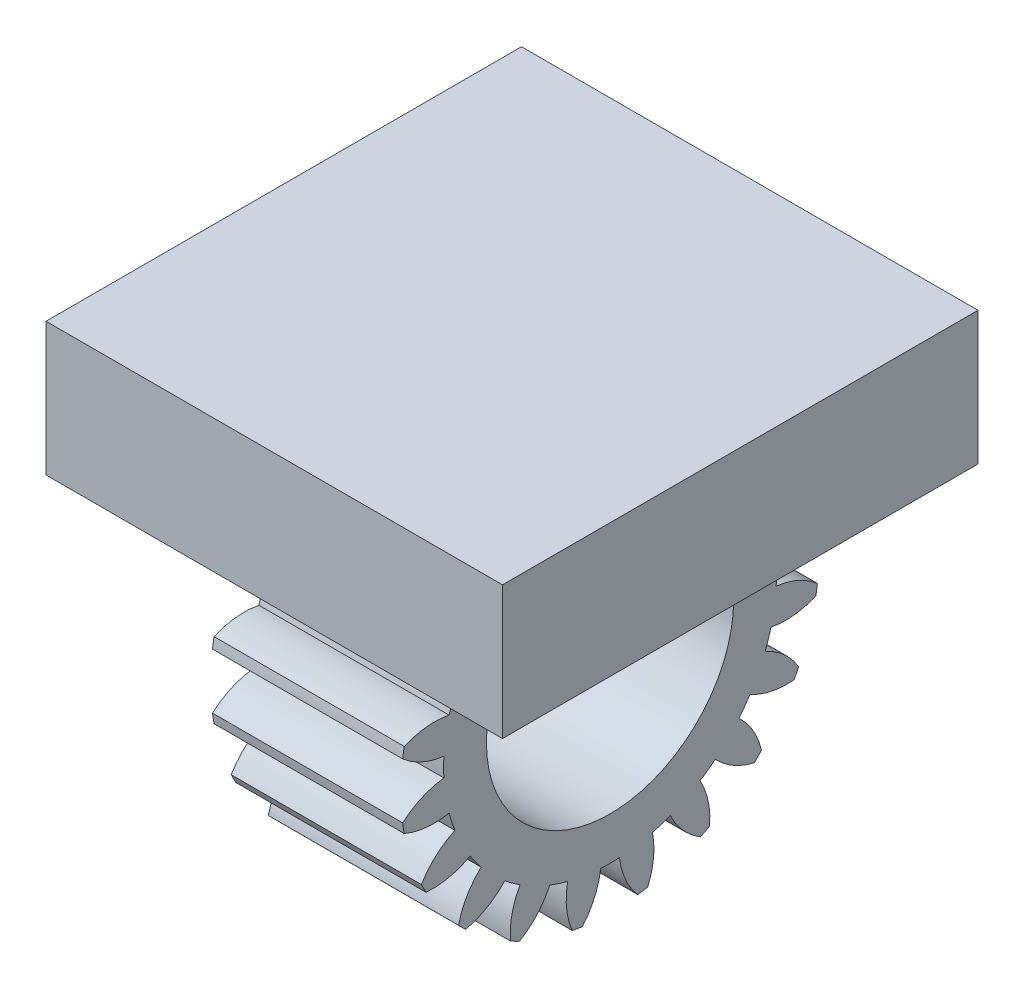
from build123d import *

# Parameters (mm, degrees)
SKETCH1_R                = 13
BOSS_EXTRUDE1_DEPTH      = 20
BOSS_EXTRUDE2_DEPTH      = 14
BOSS_EXTRUDE2_DEPTH_BACK = 34
SKETCH2_W                = 50
SKETCH2_H                = 14


with BuildPart() as part:
    # Sketch1 → Boss-Extrude1 (new body)
    with BuildSketch(Plane(origin=(30.485241984, 0, 0), x_dir=(0, 0, -1), z_dir=(1, 0, 0))):
        with BuildLine():
            ThreePointArc((-45.730813467, -2.952037332), (-43.709327628, -4.244029096), (-41.395669142, -4.878562094))
            ThreePointArc((-41.395669142, -4.878562094), (-41.423479526, -5.864733686), (-41.395669142, -6.850905277))
            ThreePointArc((-41.395669142, -6.850905277), (-43.709327628, -7.485438275), (-45.730813467, -8.777430039))
            ThreePointArc((-45.730813467, -8.777430039), (-45.653623019, -9.306291917), (-45.56360819, -9.833122612))
            ThreePointArc((-45.56360819, -9.833122612), (-43.241813498, -10.43720632), (-40.845312039, -10.325723271))
            ThreePointArc((-40.845312039, -10.325723271), (-40.567017505, -11.27222207), (-40.235824477, -12.201533107))
            ThreePointArc((-40.235824477, -12.201533107), (-42.240162977, -13.519969641), (-43.763462845, -15.373400306))
            ThreePointArc((-43.763462845, -15.373400306), (-43.526623058, -15.85252468), (-43.278214231, -16.325754333))
            ThreePointArc((-43.278214231, -16.325754333), (-40.883384128, -16.182798063), (-38.638625955, -15.336211705))
            ThreePointArc((-38.638625955, -15.336211705), (-38.081467911, -16.150387816), (-37.47931172, -16.931870859))
            ThreePointArc((-37.47931172, -16.931870859), (-38.978131616, -18.805153175), (-39.854134309, -21.038596032))
            ThreePointArc((-39.854134309, -21.038596032), (-39.480828712, -21.421082872), (-39.098341873, -21.794388468))
            ThreePointArc((-39.098341873, -21.794388468), (-36.864899015, -20.918385775), (-34.991616699, -19.419565879))
            ThreePointArc((-34.991616699, -19.419565879), (-34.210133656, -20.02172207), (-33.395957546, -20.578880114))
            ThreePointArc((-33.395957546, -20.578880114), (-34.242543904, -22.823638287), (-34.385500174, -25.21846839))
            ThreePointArc((-34.385500174, -25.21846839), (-33.91227052, -25.466877218), (-33.433146146, -25.703717004))
            ThreePointArc((-33.433146146, -25.703717004), (-31.579715481, -24.180417136), (-30.261278947, -22.176078636))
            ThreePointArc((-30.261278947, -22.176078636), (-29.331967911, -22.507271664), (-28.385469111, -22.785566198))
            ThreePointArc((-28.385469111, -22.785566198), (-28.49695216, -25.182067658), (-27.892868452, -27.50386235))
            ThreePointArc((-27.892868452, -27.50386235), (-27.366037757, -27.593877179), (-26.83717588, -27.671067627))
            ThreePointArc((-26.83717588, -27.671067627), (-25.545184115, -25.649581788), (-24.910651117, -23.335923302))
            ThreePointArc((-24.910651117, -23.335923302), (-23.924479526, -23.363733686), (-22.938307935, -23.335923302))
            ThreePointArc((-22.938307935, -23.335923302), (-22.303774937, -25.649581788), (-21.011783173, -27.671067627))
            ThreePointArc((-21.011783173, -27.671067627), (-20.482921295, -27.593877179), (-19.9560906, -27.50386235))
            ThreePointArc((-19.9560906, -27.50386235), (-19.352006892, -25.182067658), (-19.463489941, -22.785566198))
            ThreePointArc((-19.463489941, -22.785566198), (-18.516991142, -22.507271664), (-17.587680105, -22.176078636))
            ThreePointArc((-17.587680105, -22.176078636), (-16.269243571, -24.180417136), (-14.415812906, -25.703717004))
            ThreePointArc((-14.415812906, -25.703717004), (-13.936688532, -25.466877218), (-13.463458878, -25.21846839))
            ThreePointArc((-13.463458878, -25.21846839), (-13.606415149, -22.823638287), (-14.453001507, -20.578880114))
            ThreePointArc((-14.453001507, -20.578880114), (-13.638825396, -20.02172207), (-12.857342353, -19.419565879))
            ThreePointArc((-12.857342353, -19.419565879), (-10.984060037, -20.918385775), (-8.75061718, -21.794388468))
            ThreePointArc((-8.75061718, -21.794388468), (-8.36813034, -21.421082872), (-7.994824744, -21.038596032))
            ThreePointArc((-7.994824744, -21.038596032), (-8.870827436, -18.805153175), (-10.369647333, -16.931870859))
            ThreePointArc((-10.369647333, -16.931870859), (-9.767491142, -16.150387816), (-9.210333097, -15.336211705))
            ThreePointArc((-9.210333097, -15.336211705), (-6.965574925, -16.182798063), (-4.570744822, -16.325754333))
            ThreePointArc((-4.570744822, -16.325754333), (-4.322335994, -15.85252468), (-4.085496208, -15.373400306))
            ThreePointArc((-4.085496208, -15.373400306), (-5.608796076, -13.519969641), (-7.613134576, -12.201533107))
            ThreePointArc((-7.613134576, -12.201533107), (-7.281941548, -11.27222207), (-7.003647014, -10.325723271))
            ThreePointArc((-7.003647014, -10.325723271), (-4.607145554, -10.43720632), (-2.285350862, -9.833122612))
            ThreePointArc((-2.285350862, -9.833122612), (-2.195336033, -9.306291917), (-2.118145585, -8.777430039))
            ThreePointArc((-2.118145585, -8.777430039), (-4.139631424, -7.485438275), (-6.45328991, -6.850905277))
            ThreePointArc((-6.45328991, -6.850905277), (-6.425479526, -5.864733686), (-6.45328991, -4.878562094))
            ThreePointArc((-6.45328991, -4.878562094), (-4.139631424, -4.244029096), (-2.118145585, -2.952037332))
            ThreePointArc((-2.118145585, -2.952037332), (-2.195336033, -2.423175455), (-2.285350862, -1.89634476))
            ThreePointArc((-2.285350862, -1.89634476), (-4.607145554, -1.292261052), (-7.003647014, -1.403744101))
            ThreePointArc((-7.003647014, -1.403744101), (-7.281941548, -0.457245301), (-7.613134576, 0.472065736))
            ThreePointArc((-7.613134576, 0.472065736), (-5.608796076, 1.79050227), (-4.085496208, 3.643932934))
            ThreePointArc((-4.085496208, 3.643932934), (-4.322335994, 4.123057309), (-4.570744822, 4.596286962))
            ThreePointArc((-4.570744822, 4.596286962), (-6.965574925, 4.453330692), (-9.210333097, 3.606744334))
            ThreePointArc((-9.210333097, 3.606744334), (-9.767491142, 4.420920444), (-10.369647333, 5.202403487))
            ThreePointArc((-10.369647333, 5.202403487), (-8.870827436, 7.075685803), (-7.994824744, 9.309128661))
            ThreePointArc((-7.994824744, 9.309128661), (-8.36813034, 9.6916155), (-8.75061718, 10.064921097))
            ThreePointArc((-8.75061718, 10.064921097), (-10.984060037, 9.188918404), (-12.857342353, 7.690098508))
            ThreePointArc((-12.857342353, 7.690098508), (-13.638825396, 8.292254699), (-14.453001507, 8.849412743))
            ThreePointArc((-14.453001507, 8.849412743), (-13.606415149, 11.094170916), (-13.463458878, 13.489001019))
            ThreePointArc((-13.463458878, 13.489001019), (-13.936688532, 13.737409846), (-14.415812906, 13.974249633))
            ThreePointArc((-14.415812906, 13.974249633), (-16.269243571, 12.450949765), (-17.587680105, 10.446611265))
            ThreePointArc((-17.587680105, 10.446611265), (-18.516991142, 10.777804293), (-19.463489941, 11.056098827))
            ThreePointArc((-19.463489941, 11.056098827), (-19.352006892, 13.452600287), (-19.9560906, 15.774394978))
            ThreePointArc((-19.9560906, 15.774394978), (-20.482921295, 15.864409807), (-21.011783173, 15.941600255))
            ThreePointArc((-21.011783173, 15.941600255), (-22.303774937, 13.920114416), (-22.938307935, 11.60645593))
            ThreePointArc((-22.938307935, 11.60645593), (-23.924479526, 11.634266314), (-24.910651117, 11.60645593))
            ThreePointArc((-24.910651117, 11.60645593), (-25.545184115, 13.920114416), (-26.83717588, 15.941600255))
            ThreePointArc((-26.83717588, 15.941600255), (-27.366037757, 15.864409807), (-27.892868452, 15.774394978))
            ThreePointArc((-27.892868452, 15.774394978), (-28.49695216, 13.452600287), (-28.385469111, 11.056098827))
            ThreePointArc((-28.385469111, 11.056098827), (-29.331967911, 10.777804293), (-30.261278947, 10.446611265))
            ThreePointArc((-30.261278947, 10.446611265), (-31.579715481, 12.450949765), (-33.433146146, 13.974249633))
            ThreePointArc((-33.433146146, 13.974249633), (-33.91227052, 13.737409846), (-34.385500174, 13.489001019))
            ThreePointArc((-34.385500174, 13.489001019), (-34.242543904, 11.094170916), (-33.395957546, 8.849412743))
            ThreePointArc((-33.395957546, 8.849412743), (-34.210133656, 8.292254699), (-34.991616699, 7.690098508))
            ThreePointArc((-34.991616699, 7.690098508), (-36.864899015, 9.188918404), (-39.098341873, 10.064921097))
            ThreePointArc((-39.098341873, 10.064921097), (-39.480828712, 9.6916155), (-39.854134309, 9.309128661))
            ThreePointArc((-39.854134309, 9.309128661), (-38.978131616, 7.075685803), (-37.47931172, 5.202403487))
            ThreePointArc((-37.47931172, 5.202403487), (-38.081467911, 4.420920444), (-38.638625955, 3.606744334))
            ThreePointArc((-38.638625955, 3.606744334), (-40.883384128, 4.453330692), (-43.278214231, 4.596286962))
            ThreePointArc((-43.278214231, 4.596286962), (-43.526623058, 4.123057309), (-43.763462845, 3.643932934))
            ThreePointArc((-43.763462845, 3.643932934), (-42.240162977, 1.79050227), (-40.235824477, 0.472065736))
            ThreePointArc((-40.235824477, 0.472065736), (-40.567017505, -0.457245301), (-40.845312039, -1.403744101))
            ThreePointArc((-40.845312039, -1.403744101), (-43.241813498, -1.292261052), (-45.56360819, -1.89634476))
            ThreePointArc((-45.56360819, -1.89634476), (-45.653623019, -2.423175455), (-45.730813467, -2.952037332))
        make_face()
        with Locations(Location((-23.924479526, -5.864733686, 0), (0, 0, 180))):
            Circle(SKETCH1_R, mode=Mode.SUBTRACT)
    extrude(amount=-BOSS_EXTRUDE1_DEPTH)

    # Sketch2 → Boss-Extrude2 (add, two sides: drawn at the far end of the back side and taken through both)
    with BuildSketch(Plane(origin=(30.485241984, 0, 0), x_dir=(0, 0, -1), z_dir=(1, 0, 0)).offset(-BOSS_EXTRUDE2_DEPTH_BACK)):
        with Locations((-24.233465749, 14.653188973)):
            Rectangle(SKETCH2_W, SKETCH2_H)
    extrude(amount=BOSS_EXTRUDE2_DEPTH + BOSS_EXTRUDE2_DEPTH_BACK)


solid = part.part
